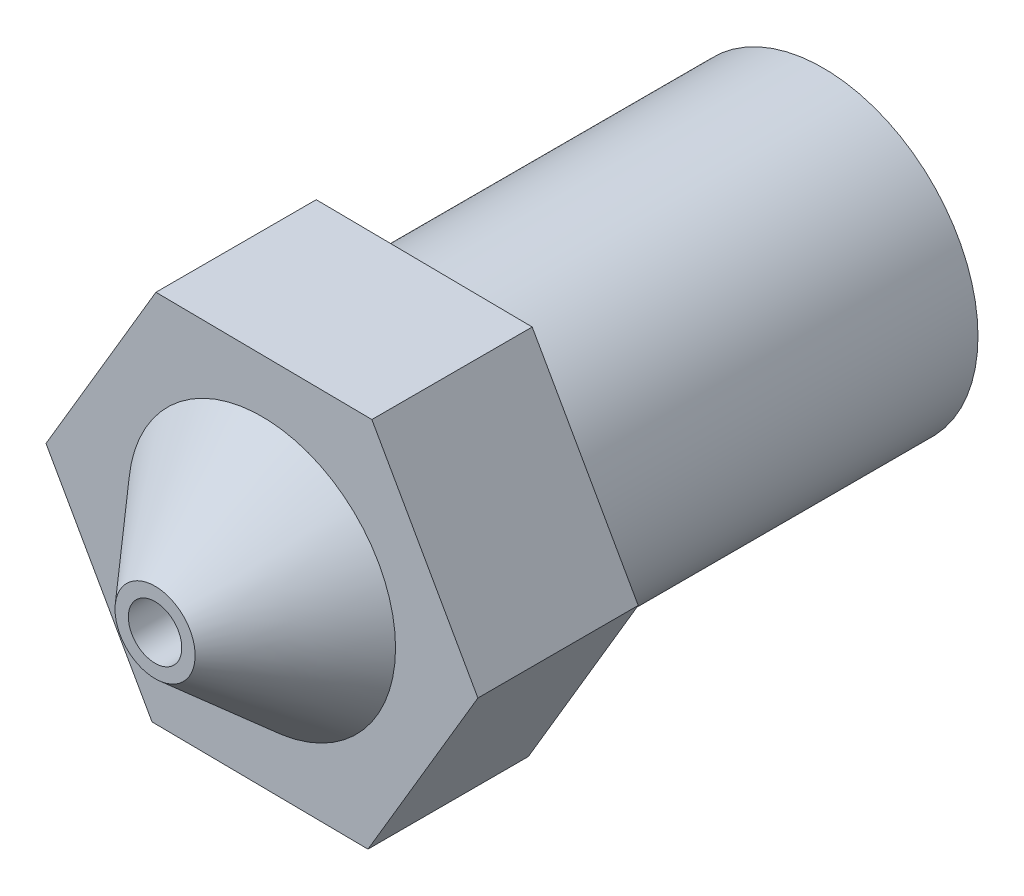
from build123d import *

# Parameters (mm, degrees)
SALIENTE_EXTRUIR1_DEPTH = 3
CROQUIS5_R              = 2.9
SALIENTE_EXTRUIR2_DEPTH = 7.5
CROQUIS4_R              = 0.875
CORTAR_EXTRUIR1_DEPTH   = 10.5


with BuildPart() as part:
    # Croquis1 → Saliente-Extruir1 (new body)
    with BuildSketch(Plane.XY):
        Polygon((-2.057275574, -3.478642055), (1.983954604, -3.520973937), (4.041230177, -0.042331882), (2.057275574, 3.478642055), (-1.983954604, 3.520973937), (-4.041230177, 0.042331882), align=None)
    extrude(amount=SALIENTE_EXTRUIR1_DEPTH)

    # Croquis3 → Revolución1 (revolve)
    with BuildSketch(Plane(origin=(0, 0, 0), x_dir=(1, 0, 0), z_dir=(0, 1, 0))):
        Polygon((-0.5, -5), (-0.75, -5), (-2.5, -3), (-0.5, -3), align=None)
    revolve(axis=Axis((0, 0, 0), (0, 0, 1)))

    # Croquis5 → Saliente-Extruir2 (add)
    with BuildSketch(Plane(origin=(0, 0, 0), x_dir=(-1, 0, 0), z_dir=(0, 0, -1))):
        Circle(CROQUIS5_R)
    extrude(amount=SALIENTE_EXTRUIR2_DEPTH)

    # Croquis4 → Cortar-Extruir1 (cut)
    with BuildSketch(Plane.XY.offset(3)):
        Circle(CROQUIS4_R)
    extrude(amount=-CORTAR_EXTRUIR1_DEPTH, mode=Mode.SUBTRACT)


solid = part.part
